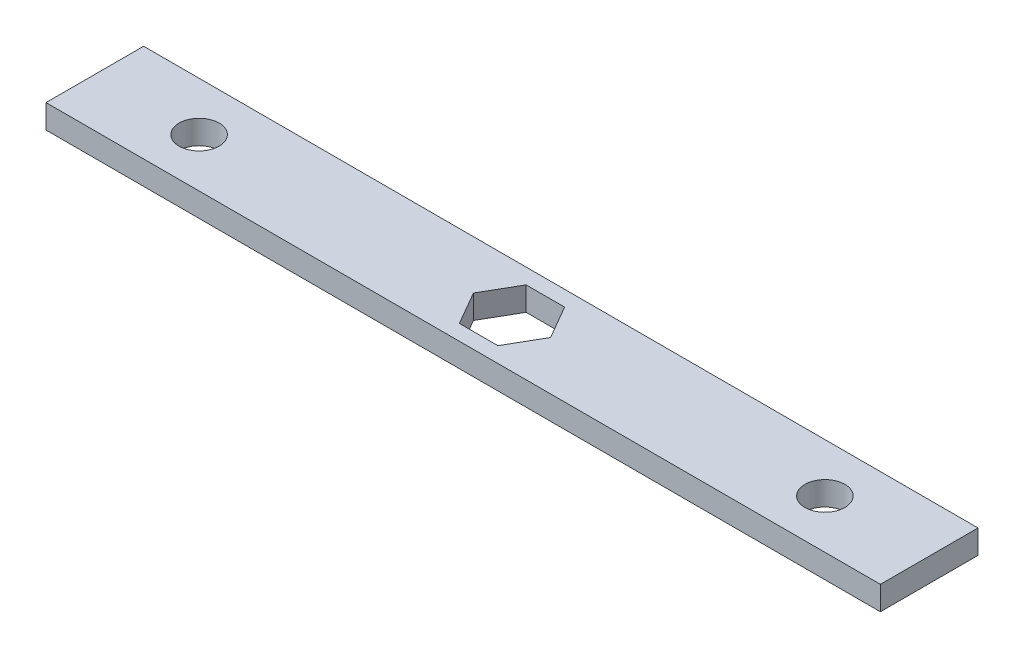
from build123d import *

# Parameters (mm, degrees)
SKETCH1_W           = 100
SKETCH1_H           = 11.7
BOSS_EXTRUDE1_DEPTH = 2.85
CUT_EXTRUDE1_DEPTH  = 51.421671928
SKETCH3_R           = 2.4
CUT_EXTRUDE2_DEPTH  = 51.421671928


with BuildPart() as part:
    # Sketch1 → Boss-Extrude1 (new body)
    with BuildSketch(Plane(origin=(0, 0, 0), x_dir=(1, 0, 0), z_dir=(0, 1, 0))):
        Rectangle(SKETCH1_W, SKETCH1_H)
    extrude(amount=BOSS_EXTRUDE1_DEPTH)

    # Sketch2 → Cut-Extrude1 (cut, through all)
    with BuildSketch(Plane.XZ):
        Polygon((-2.309401077, 4), (2.309401077, 4), (4.618802154, 0), (2.309401077, -4), (-2.309401077, -4), (-4.618802154, 0), align=None)
    extrude(amount=-CUT_EXTRUDE1_DEPTH, mode=Mode.SUBTRACT)

    # Sketch3 → Cut-Extrude2 (cut, through all)
    with BuildSketch(Plane(origin=(0, 2.85, 0), x_dir=(1, 0, 0), z_dir=(0, 1, 0))):
        with Locations(Location((-37.5, 0, 0), (0, 0, 270))):
            Circle(SKETCH3_R)
        with Locations(Location((37.5, 0, 0), (0, 0, 270))):
            Circle(SKETCH3_R)
    extrude(amount=-CUT_EXTRUDE2_DEPTH, mode=Mode.SUBTRACT)


solid = part.part
